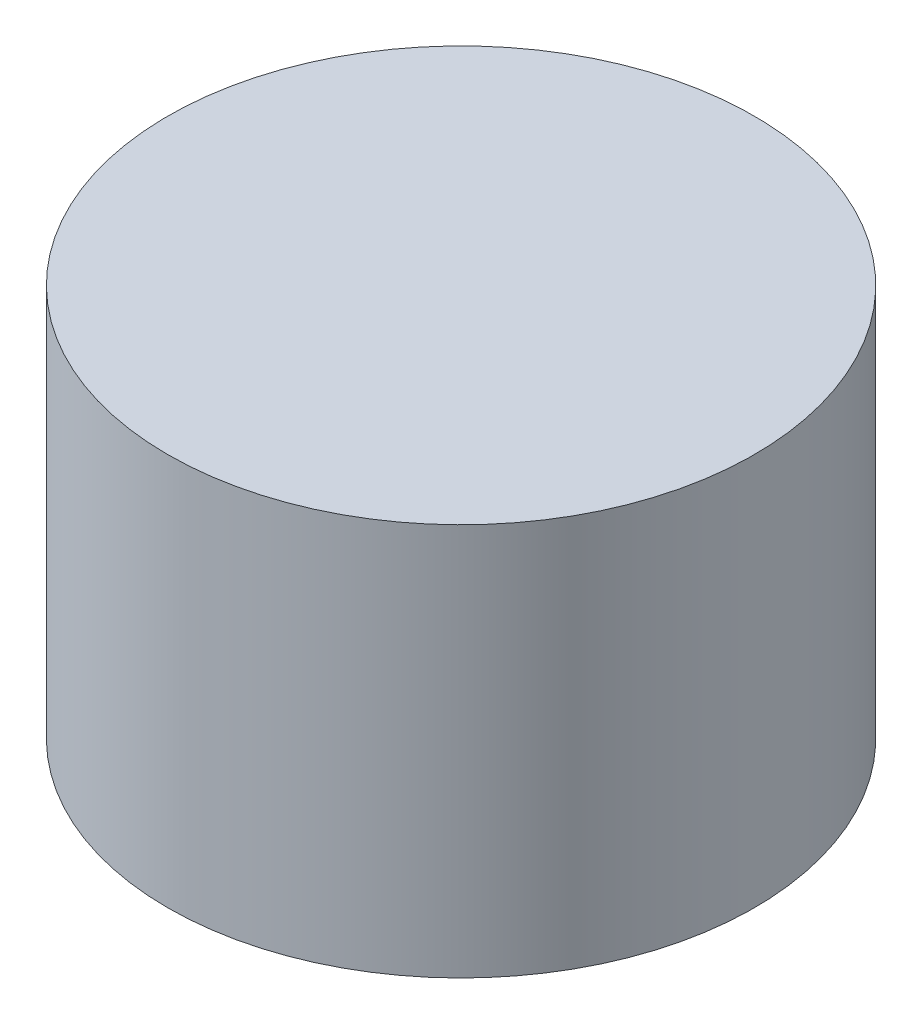
from build123d import *

# Parameters (mm, degrees)
SKETCH1_R           = 3.175
BOSS_EXTRUDE1_DEPTH = 4.25


with BuildPart() as part:
    # Sketch1 → Boss-Extrude1 (new body)
    with BuildSketch(Plane(origin=(0, 0, 0), x_dir=(1, 0, 0), z_dir=(0, 1, 0))):
        with Locations(Location((0, 0, 0), (0, 0, 270))):
            Circle(SKETCH1_R)
    extrude(amount=BOSS_EXTRUDE1_DEPTH)


solid = part.part
